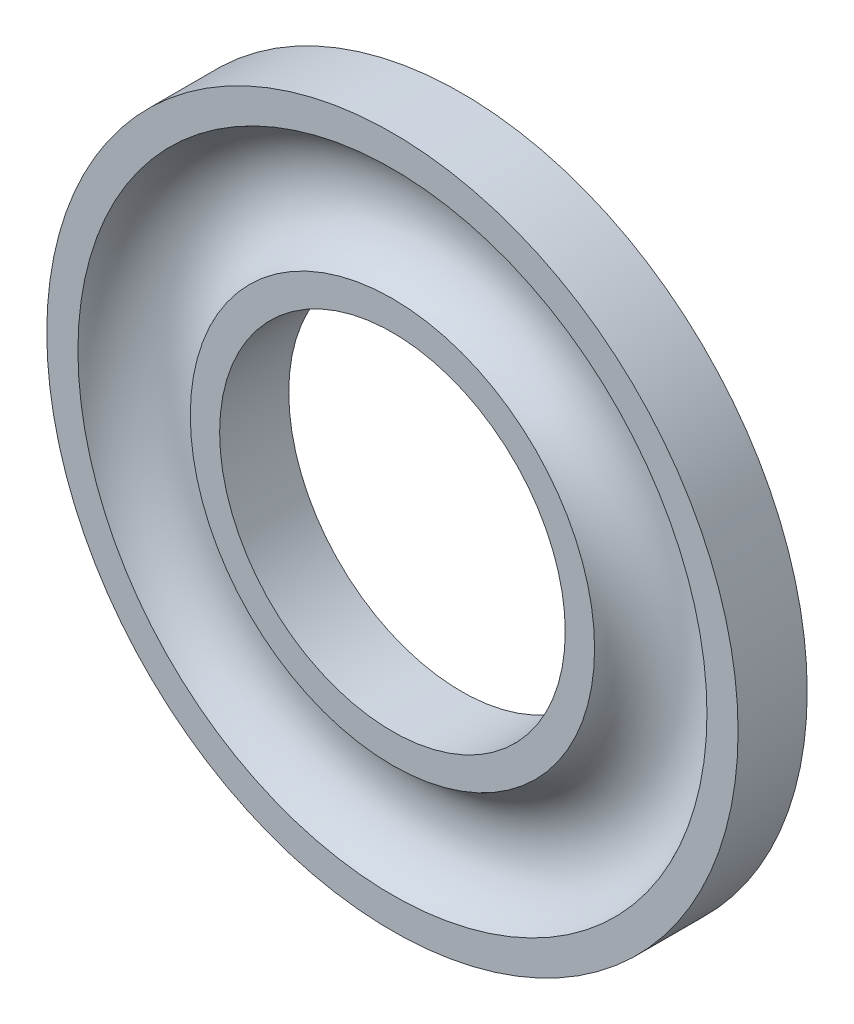
from build123d import *

# Parameters (mm, degrees)
SKETCH_1_R      = 20
SKETCH_1_R_2    = 10
EXTRUDE_1_DEPTH = 4
SKETCH_3_R      = 3.5


with BuildPart() as part:
    # Эскиз1 → Вытянуть1 (new body)
    with BuildSketch(Plane.XY):
        Circle(SKETCH_1_R)
        Circle(SKETCH_1_R_2, mode=Mode.SUBTRACT)
    extrude(amount=EXTRUDE_1_DEPTH)

    # Вырез-По траектории1: sweep along a path in Эскиз2
    with BuildLine(Plane.XY.offset(4)) as sweep_1_path:
        CenterArc((0, 0), 15, 0, 360)
    # Эскиз3 → Вырез-По траектории1 (sweep, cut)
    with BuildSketch(Plane(origin=(0, 0, 0), x_dir=(1, 0, 0), z_dir=(0, 1, 0))):
        with Locations((14.947787098, -5.295049555)):
            Circle(SKETCH_3_R)
    sweep(path=sweep_1_path.line, mode=Mode.SUBTRACT)


solid = part.part
